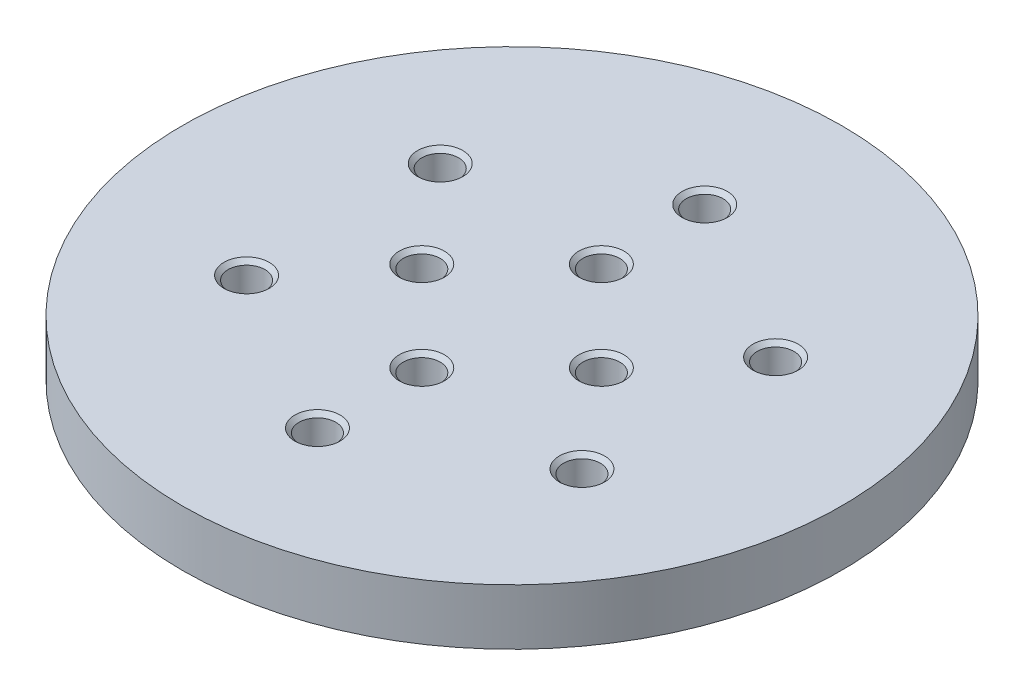
from build123d import *

# Parameters (mm, degrees)
SKETCH_1_R               = 29.5
EXTRUDE_1_DEPTH          = 5
PATTERN_CIRCULAR_1_COUNT = 4
PATTERN_CIRCULAR_2_COUNT = 6


with BuildPart() as part:
    # 草图1 → 凸台-拉伸1 (new body)
    with BuildSketch(Plane(origin=(0, 0, 0), x_dir=(1, 0, 0), z_dir=(0, 1, 0))):
        with Locations(Location((0, 0, 0), (0, 0, 270))):
            Circle(SKETCH_1_R)
    extrude(amount=EXTRUDE_1_DEPTH)

    # 草图3 → M4 螺纹孔1 (revolve, cut)
    with BuildSketch(Plane(origin=(0, 5, -8), x_dir=(0, 0, 1), z_dir=(1, 0, 0))):
        Polygon((0, 0), (0, 11.091420021), (1.65, 10.1), (1.65, 0.375), (2.025, 0), align=None)
    hole_wizard_m4_1 = revolve(axis=Axis((0, 11.35, -8), (0, -1, 0)), mode=Mode.SUBTRACT)

    # 阵列(圆周)1: M4 螺纹孔1 ×4 about axis
    pattern_circular_1_axis = Axis((0, 0, 0.037874529), (0, 1, 0))
    for i in range(1, PATTERN_CIRCULAR_1_COUNT):
        add(hole_wizard_m4_1.rotate(pattern_circular_1_axis, i * 360 / PATTERN_CIRCULAR_1_COUNT), mode=Mode.SUBTRACT)

    # 草图5 → M4 螺纹孔2 (revolve, cut)
    with BuildSketch(Plane(origin=(0, 5, -17.25), x_dir=(0, 0, 1), z_dir=(1, 0, 0))):
        Polygon((0, 0), (0, 11.091420021), (1.65, 10.1), (1.65, 0.375), (2.025, 0), align=None)
    hole_wizard_m4_2 = revolve(axis=Axis((0, 11.35, -17.25), (0, -1, 0)), mode=Mode.SUBTRACT)

    # 阵列(圆周)2: M4 螺纹孔2 ×6 about axis
    pattern_circular_2_axis = Axis((0, 0, 0.082512271), (0, 1, 0))
    for i in range(1, PATTERN_CIRCULAR_2_COUNT):
        add(hole_wizard_m4_2.rotate(pattern_circular_2_axis, i * 360 / PATTERN_CIRCULAR_2_COUNT), mode=Mode.SUBTRACT)


solid = part.part
